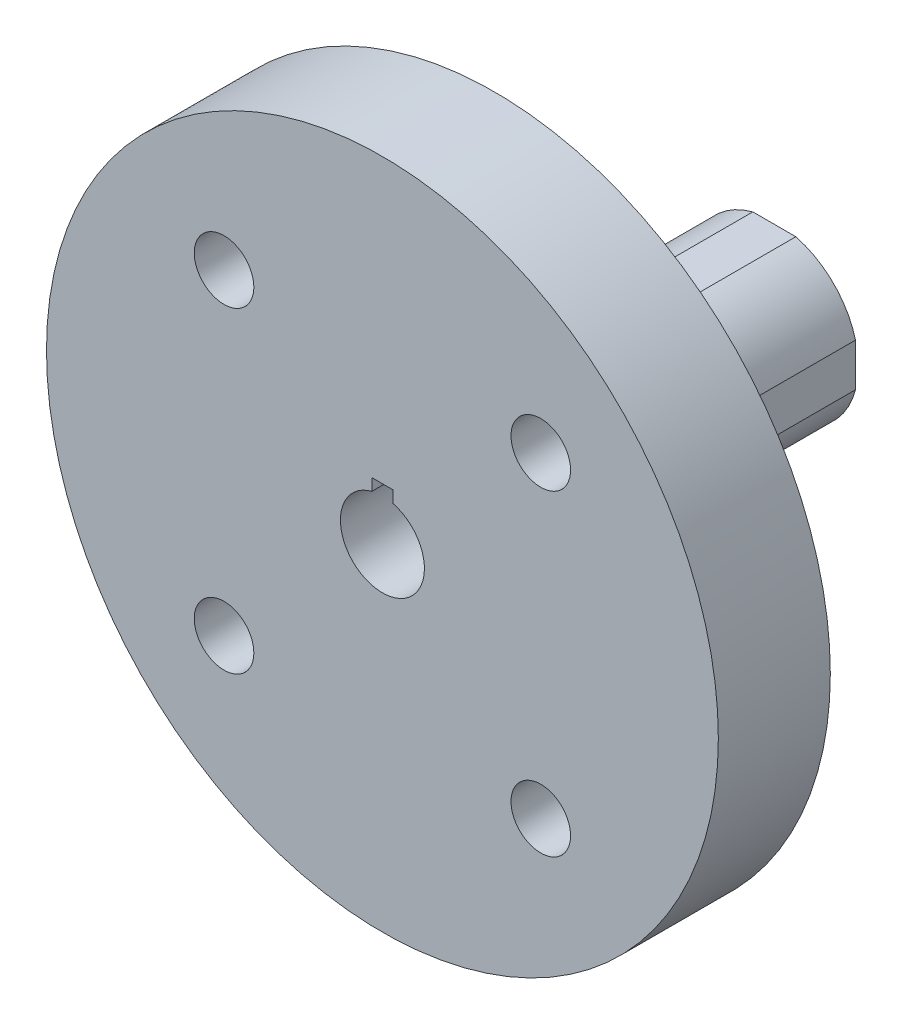
from build123d import *

# Parameters (mm, degrees)
SKETCH1_R            = 76.2
BOSS_EXTRUDE1_DEPTH  = 25.4
SKETCH2_R            = 19.05
BOSS_EXTRUDE2_DEPTH  = 63.5
CUT_EXTRUDE1_START   = -63.5
CUT_EXTRUDE1_DEPTH   = 63.5
SKETCH6_W            = 9.7550551
SKETCH6_H            = 31.75
BOSS_EXTRUDE7_DEPTH  = 31.75
CUT_EXTRUDE2_DEPTH   = 31.75
SKETCH8_R            = 9.525
CUT_EXTRUDE3_DEPTH   = 140.7
CUT_EXTRUDE4_DEPTH   = 140.7
SKETCH11_W           = 9.7550551
SKETCH11_H           = 31.75
BOSS_EXTRUDE8_DEPTH  = 31.75
CUT_EXTRUDE5_DEPTH   = 129.110325398
SKETCH13_W           = 31.75
SKETCH13_H           = 9.7550551
BOSS_EXTRUDE9_DEPTH  = 31.75
CUT_EXTRUDE6_DEPTH   = 129.110325398
SKETCH15_W           = 31.75
SKETCH15_H           = 9.7550551
BOSS_EXTRUDE10_DEPTH = 31.75
CUT_EXTRUDE7_DEPTH   = 129.110325398
SKETCH17_R           = 6.7564
CUT_EXTRUDE8_DEPTH   = 140.7


with BuildPart() as part:
    # Sketch1 → Boss-Extrude1 (new body)
    with BuildSketch(Plane.XY):
        Circle(SKETCH1_R)
    extrude(amount=BOSS_EXTRUDE1_DEPTH)

    # Sketch2 → Boss-Extrude2 (add)
    with BuildSketch(Plane(origin=(0, 0, 0), x_dir=(-1, 0, 0), z_dir=(0, 0, -1))):
        Circle(SKETCH2_R)
    extrude(amount=BOSS_EXTRUDE2_DEPTH)

    # Sketch4 → Cut-Extrude1 (cut)
    with BuildSketch(Plane(origin=(0, 0, -63.5), x_dir=(-1, 0, 0), z_dir=(0, 0, -1)).offset(CUT_EXTRUDE1_START)):
        with BuildLine():
            Line((-4.87752755, 18.415), (4.87752755, 18.415))
            ThreePointArc((4.87752755, 18.415), (0, 19.05), (-4.87752755, 18.415))
        make_face()
        with BuildLine():
            Line((-18.415, 4.87752755), (-18.415, -4.87752755))
            ThreePointArc((-18.415, -4.87752755), (-19.05, 0), (-18.415, 4.87752755))
        make_face()
        with BuildLine():
            Line((4.87752755, -18.415), (-4.87752755, -18.415))
            ThreePointArc((-4.87752755, -18.415), (0, -19.05), (4.87752755, -18.415))
        make_face()
        with BuildLine():
            Line((18.415, 4.87752755), (18.415, -4.87752755))
            ThreePointArc((18.415, -4.87752755), (19.05, 0), (18.415, 4.87752755))
        make_face()
    extrude(amount=CUT_EXTRUDE1_DEPTH, mode=Mode.SUBTRACT)

    # Sketch6 → Boss-Extrude7 (add)
    with BuildSketch(Plane(origin=(0, 0, 0), x_dir=(-1, 0, 0), z_dir=(0, 0, -1))):
        with Locations((0, 34.29)):
            Rectangle(SKETCH6_W, SKETCH6_H)
    extrude(amount=BOSS_EXTRUDE7_DEPTH)

    # Sketch7 → Cut-Extrude2 (cut)
    with BuildSketch(Plane(origin=(4.87752755, 0, 0), x_dir=(0, 0, -1), z_dir=(1, 0, 0))):
        Polygon((31.75, 18.415), (0, 50.165), (31.75, 50.165), align=None)
    extrude(amount=-CUT_EXTRUDE2_DEPTH, mode=Mode.SUBTRACT)

    # Sketch8 → Cut-Extrude3 (cut, through all)
    with BuildSketch(Plane.XY.offset(25.4)):
        Circle(SKETCH8_R)
    extrude(amount=-CUT_EXTRUDE3_DEPTH, mode=Mode.SUBTRACT)

    # Sketch9 → Cut-Extrude4 (cut, through all)
    with BuildSketch(Plane.XY.offset(25.4)):
        with BuildLine():
            Line((-2.38125, 11.90625), (-2.38125, 9.222541593))
            ThreePointArc((-2.38125, 9.222541593), (0, 9.525), (2.38125, 9.222541593))
            Line((2.38125, 9.222541593), (2.38125, 11.90625))
            Line((2.38125, 11.90625), (-2.38125, 11.90625))
        make_face()
    extrude(amount=-CUT_EXTRUDE4_DEPTH, mode=Mode.SUBTRACT)

    # Sketch11 → Boss-Extrude8 (add)
    with BuildSketch(Plane(origin=(0, 0, 0), x_dir=(-1, 0, 0), z_dir=(0, 0, -1))):
        with Locations((0, -34.29)):
            Rectangle(SKETCH11_W, SKETCH11_H)
    extrude(amount=BOSS_EXTRUDE8_DEPTH)

    # Sketch12 → Cut-Extrude5 (cut, through all)
    with BuildSketch(Plane.ZY.offset(4.87752755)):
        Polygon((-31.75, -18.415), (0, -50.165), (-31.75, -50.165), align=None)
    extrude(amount=-CUT_EXTRUDE5_DEPTH, mode=Mode.SUBTRACT)

    # Sketch13 → Boss-Extrude9 (add)
    with BuildSketch(Plane(origin=(0, 0, 0), x_dir=(-1, 0, 0), z_dir=(0, 0, -1))):
        with Locations((34.29, 0)):
            Rectangle(SKETCH13_W, SKETCH13_H)
    extrude(amount=BOSS_EXTRUDE9_DEPTH)

    # Sketch14 → Cut-Extrude6 (cut, through all)
    with BuildSketch(Plane(origin=(0, 4.87752755, 0), x_dir=(1, 0, 0), z_dir=(0, 1, 0))):
        Polygon((-18.415, 31.75), (-50.165, 0), (-50.165, 31.75), align=None)
    extrude(amount=-CUT_EXTRUDE6_DEPTH, mode=Mode.SUBTRACT)

    # Sketch15 → Boss-Extrude10 (add)
    with BuildSketch(Plane(origin=(0, 0, 0), x_dir=(-1, 0, 0), z_dir=(0, 0, -1))):
        with Locations((-34.29, 0)):
            Rectangle(SKETCH15_W, SKETCH15_H)
    extrude(amount=BOSS_EXTRUDE10_DEPTH)

    # Sketch16 → Cut-Extrude7 (cut, through all)
    with BuildSketch(Plane.XZ.offset(4.87752755)):
        Polygon((18.415, -31.75), (50.165, 0), (50.165, -31.75), align=None)
    extrude(amount=-CUT_EXTRUDE7_DEPTH, mode=Mode.SUBTRACT)

    # Sketch17 → Cut-Extrude8 (cut, through all)
    with BuildSketch(Plane.XY.offset(25.4)):
        with Locations((35.921024484, 35.921024484)):
            Circle(SKETCH17_R)
        with Locations((-35.921024484, -35.921024484)):
            Circle(SKETCH17_R)
        with Locations((-35.921024484, 35.921024484)):
            Circle(SKETCH17_R)
        with Locations((35.921024484, -35.921024484)):
            Circle(SKETCH17_R)
    extrude(amount=-CUT_EXTRUDE8_DEPTH, mode=Mode.SUBTRACT)


solid = part.part
